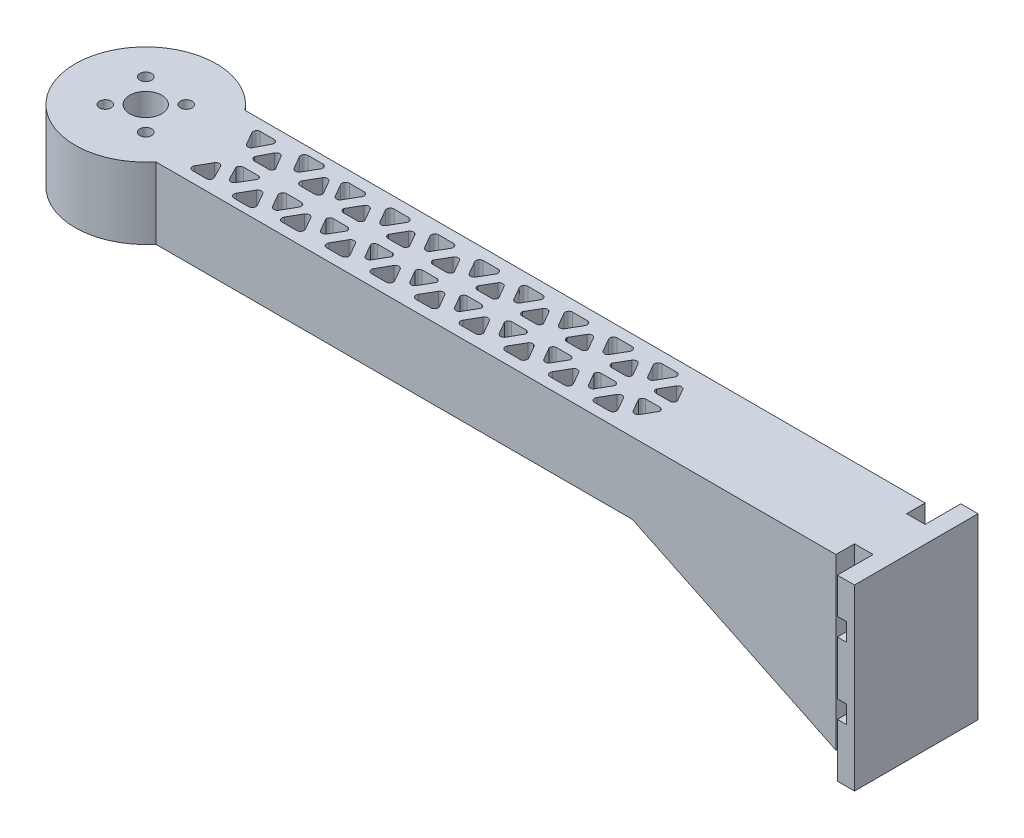
from build123d import *

# Parameters (mm, degrees)
SKETCH1_R           = 1.65
SKETCH1_R_2         = 4.5
BOSS_EXTRUDE1_DEPTH = 20
BOSS_EXTRUDE2_DEPTH = 50
BOSS_EXTRUDE3_DEPTH = 25
CUT_EXTRUDE1_REACH  = 224.387
SKETCH2_4_W         = 5.2
SKETCH2_4_H         = 5.2
CUT_EXTRUDE2_REACH  = 222.99
SKETCH4_W           = 2.5
SKETCH4_H           = 5
SKETCH4_W_2         = 0.1


with BuildPart() as part:
    # Sketch1 → Boss-Extrude1 (new body)
    with BuildSketch(Plane(origin=(0, 0, 0), x_dir=(1, 0, 0), z_dir=(0, 1, 0))):
        with BuildLine():
            Line((215.781228136, 12.419661208), (15.251683783, 12.419661208))
            ThreePointArc((15.251683783, 12.419661208), (-19.862171776, -0.080338792), (15.251683783, -12.580338792))
            Line((15.251683783, -12.580338792), (215.781228136, -12.580338792))
            Line((215.781228136, -12.580338792), (215.781228136, 12.419661208))
        make_face()
        with BuildLine():
            ThreePointArc((40.028484267, -8.923117966), (40.028697604, -9.947176998), (39.141872006, -10.459268109))
            Line((39.141872006, -10.459268109), (35.007344818, -10.459268109))
            ThreePointArc((35.007344818, -10.459268109), (34.12051922, -9.947176998), (34.120732557, -8.923117966))
            Line((34.120732557, -8.923117966), (36.187996151, -5.34480815))
            ThreePointArc((36.187996151, -5.34480815), (37.074608412, -4.833086491), (37.961220673, -5.34480815))
            Line((37.961220673, -5.34480815), (40.028484267, -8.923117966))
        make_face(mode=Mode.SUBTRACT)
        with BuildLine():
            Line((21.614703637, -8.12452744), (23.681967231, -4.546217624))
            ThreePointArc((23.681967231, -4.546217624), (24.543612682, -4.061494427), (25.383043849, -4.583744154))
            Line((25.383043849, -4.583744154), (27.244871966, -8.162053969))
            ThreePointArc((27.244871966, -8.162053969), (27.213581729, -9.113447541), (26.384038862, -9.580338792))
            Line((26.384038862, -9.580338792), (22.454947151, -9.580338792))
            ThreePointArc((22.454947151, -9.580338792), (21.614501458, -9.095029425), (21.614703637, -8.12452744))
        make_face(mode=Mode.SUBTRACT)
        with BuildLine():
            ThreePointArc((27.803132488, -2.735420106), (28.041756396, -1.959117555), (28.760166912, -1.580338792))
            Line((28.760166912, -1.580338792), (33.170984506, -1.580338792))
            ThreePointArc((33.170984506, -1.580338792), (33.622927159, -1.975727629), (33.775469807, -2.556516089))
            Line((33.775469807, -2.556516089), (31.573625479, -6.255367121))
            ThreePointArc((31.573625479, -6.255367121), (30.697555502, -6.931576396), (29.718236674, -6.416122982))
            Line((29.718236674, -6.416122982), (27.803132488, -2.735420106))
        make_face(mode=Mode.SUBTRACT)
        with BuildLine():
            Line((46.634703637, -7.963849857), (48.701967231, -4.385540041))
            ThreePointArc((48.701967231, -4.385540041), (49.588579492, -3.873818381), (50.475191753, -4.385540041))
            Line((50.475191753, -4.385540041), (52.542455347, -7.963849857))
            ThreePointArc((52.542455347, -7.963849857), (52.542668684, -8.987908889), (51.655843086, -9.5))
            Line((51.655843086, -9.5), (47.521315898, -9.5))
            ThreePointArc((47.521315898, -9.5), (46.6344903, -8.987908889), (46.634703637, -7.963849857))
        make_face(mode=Mode.SUBTRACT)
        with BuildLine():
            Line((59.144703637, -7.963849857), (61.211967231, -4.385540041))
            ThreePointArc((61.211967231, -4.385540041), (62.098579492, -3.873818381), (62.985191753, -4.385540041))
            Line((62.985191753, -4.385540041), (65.052455347, -7.963849857))
            ThreePointArc((65.052455347, -7.963849857), (65.052668684, -8.987908889), (64.165843086, -9.5))
            Line((64.165843086, -9.5), (60.031315898, -9.5))
            ThreePointArc((60.031315898, -9.5), (59.1444903, -8.987908889), (59.144703637, -7.963849857))
        make_face(mode=Mode.SUBTRACT)
        with BuildLine():
            Line((71.654703637, -7.963849857), (73.721967231, -4.385540041))
            ThreePointArc((73.721967231, -4.385540041), (74.608579492, -3.873818381), (75.495191753, -4.385540041))
            Line((75.495191753, -4.385540041), (77.562455347, -7.963849857))
            ThreePointArc((77.562455347, -7.963849857), (77.562668684, -8.987908889), (76.675843086, -9.5))
            Line((76.675843086, -9.5), (72.541315898, -9.5))
            ThreePointArc((72.541315898, -9.5), (71.6544903, -8.987908889), (71.654703637, -7.963849857))
        make_face(mode=Mode.SUBTRACT)
        with BuildLine():
            Line((84.164703637, -7.963849857), (86.231967231, -4.385540041))
            ThreePointArc((86.231967231, -4.385540041), (87.118579492, -3.873818381), (88.005191753, -4.385540041))
            Line((88.005191753, -4.385540041), (90.072455347, -7.963849857))
            ThreePointArc((90.072455347, -7.963849857), (90.072668684, -8.987908889), (89.185843086, -9.5))
            Line((89.185843086, -9.5), (85.051315898, -9.5))
            ThreePointArc((85.051315898, -9.5), (84.1644903, -8.987908889), (84.164703637, -7.963849857))
        make_face(mode=Mode.SUBTRACT)
        with BuildLine():
            Line((46.281498727, -3.523632181), (44.214235133, -7.101941997))
            ThreePointArc((44.214235133, -7.101941997), (43.327622872, -7.613663657), (42.441010611, -7.101941997))
            Line((42.441010611, -7.101941997), (40.373261673, -3.514943175))
            ThreePointArc((40.373261673, -3.514943175), (40.373776477, -2.491304726), (41.260359278, -1.979634055))
            Line((41.260359278, -1.979634055), (45.394886466, -1.979634055))
            ThreePointArc((45.394886466, -1.979634055), (46.287424275, -2.493670166), (46.281498727, -3.523632181))
        make_face(mode=Mode.SUBTRACT)
        with BuildLine():
            ThreePointArc((52.887718097, -2.564364072), (53.123716588, -1.859495358), (53.774330358, -1.5))
            Line((53.774330358, -1.5), (57.908857546, -1.5))
            ThreePointArc((57.908857546, -1.5), (58.556731527, -1.85658781), (58.795469807, -2.556516089))
            Line((58.795469807, -2.556516089), (56.728206213, -6.142673887))
            ThreePointArc((56.728206213, -6.142673887), (55.841593952, -6.654395547), (54.954981691, -6.142673887))
            Line((54.954981691, -6.142673887), (52.887718097, -2.564364072))
        make_face(mode=Mode.SUBTRACT)
        with BuildLine():
            ThreePointArc((65.397718097, -2.564364072), (65.633716588, -1.859495358), (66.284330358, -1.5))
            Line((66.284330358, -1.5), (70.418857546, -1.5))
            ThreePointArc((70.418857546, -1.5), (71.066731527, -1.85658781), (71.305469807, -2.556516089))
            Line((71.305469807, -2.556516089), (69.238206213, -6.142673887))
            ThreePointArc((69.238206213, -6.142673887), (68.351593952, -6.654395547), (67.464981691, -6.142673887))
            Line((67.464981691, -6.142673887), (65.397718097, -2.564364072))
        make_face(mode=Mode.SUBTRACT)
        with BuildLine():
            ThreePointArc((77.907718097, -2.564364072), (78.143716588, -1.859495358), (78.794330358, -1.5))
            Line((78.794330358, -1.5), (82.928857546, -1.5))
            ThreePointArc((82.928857546, -1.5), (83.576731527, -1.85658781), (83.815469807, -2.556516089))
            Line((83.815469807, -2.556516089), (81.748206213, -6.142673887))
            ThreePointArc((81.748206213, -6.142673887), (80.861593952, -6.654395547), (79.974981691, -6.142673887))
            Line((79.974981691, -6.142673887), (77.907718097, -2.564364072))
        make_face(mode=Mode.SUBTRACT)
        with BuildLine():
            ThreePointArc((90.417718097, -2.564364072), (90.653716588, -1.859495358), (91.304330358, -1.5))
            Line((91.304330358, -1.5), (95.438857546, -1.5))
            ThreePointArc((95.438857546, -1.5), (96.086731527, -1.85658781), (96.325469807, -2.556516089))
            Line((96.325469807, -2.556516089), (94.258206213, -6.142673887))
            ThreePointArc((94.258206213, -6.142673887), (93.371593952, -6.654395547), (92.484981691, -6.142673887))
            Line((92.484981691, -6.142673887), (90.417718097, -2.564364072))
        make_face(mode=Mode.SUBTRACT)
        with BuildLine():
            Line((96.674703637, -7.963849857), (98.741967231, -4.385540041))
            ThreePointArc((98.741967231, -4.385540041), (99.628579492, -3.873818381), (100.515191753, -4.385540041))
            Line((100.515191753, -4.385540041), (102.582455347, -7.963849857))
            ThreePointArc((102.582455347, -7.963849857), (102.582668684, -8.987908889), (101.695843086, -9.5))
            Line((101.695843086, -9.5), (97.561315898, -9.5))
            ThreePointArc((97.561315898, -9.5), (96.6744903, -8.987908889), (96.674703637, -7.963849857))
        make_face(mode=Mode.SUBTRACT)
        with BuildLine():
            Line((109.184703637, -7.963849857), (111.251967231, -4.385540041))
            ThreePointArc((111.251967231, -4.385540041), (112.138579492, -3.873818381), (113.025191753, -4.385540041))
            Line((113.025191753, -4.385540041), (115.092455347, -7.963849857))
            ThreePointArc((115.092455347, -7.963849857), (115.092668684, -8.987908889), (114.205843086, -9.5))
            Line((114.205843086, -9.5), (110.071315898, -9.5))
            ThreePointArc((110.071315898, -9.5), (109.1844903, -8.987908889), (109.184703637, -7.963849857))
        make_face(mode=Mode.SUBTRACT)
        with BuildLine():
            Line((121.694703637, -7.963849857), (123.761967231, -4.385540041))
            ThreePointArc((123.761967231, -4.385540041), (124.648579492, -3.873818381), (125.535191753, -4.385540041))
            Line((125.535191753, -4.385540041), (127.602455347, -7.963849857))
            ThreePointArc((127.602455347, -7.963849857), (127.602668684, -8.987908889), (126.715843086, -9.5))
            Line((126.715843086, -9.5), (122.581315898, -9.5))
            ThreePointArc((122.581315898, -9.5), (121.6944903, -8.987908889), (121.694703637, -7.963849857))
        make_face(mode=Mode.SUBTRACT)
        with BuildLine():
            Line((134.204703637, -7.963849857), (136.271967231, -4.385540041))
            ThreePointArc((136.271967231, -4.385540041), (137.158579492, -3.873818381), (138.045191753, -4.385540041))
            Line((138.045191753, -4.385540041), (140.112455347, -7.963849857))
            ThreePointArc((140.112455347, -7.963849857), (140.112668684, -8.987908889), (139.225843086, -9.5))
            Line((139.225843086, -9.5), (135.091315898, -9.5))
            ThreePointArc((135.091315898, -9.5), (134.2044903, -8.987908889), (134.204703637, -7.963849857))
        make_face(mode=Mode.SUBTRACT)
        with BuildLine():
            ThreePointArc((102.927718097, -2.564364072), (103.163716588, -1.859495358), (103.814330358, -1.5))
            Line((103.814330358, -1.5), (107.948857546, -1.5))
            ThreePointArc((107.948857546, -1.5), (108.596731527, -1.85658781), (108.835469807, -2.556516089))
            Line((108.835469807, -2.556516089), (106.768206213, -6.142673887))
            ThreePointArc((106.768206213, -6.142673887), (105.881593952, -6.654395547), (104.994981691, -6.142673887))
            Line((104.994981691, -6.142673887), (102.927718097, -2.564364072))
        make_face(mode=Mode.SUBTRACT)
        with BuildLine():
            ThreePointArc((115.437718097, -2.564364072), (115.673716588, -1.859495358), (116.324330358, -1.5))
            Line((116.324330358, -1.5), (120.458857546, -1.5))
            ThreePointArc((120.458857546, -1.5), (121.106731527, -1.85658781), (121.345469807, -2.556516089))
            Line((121.345469807, -2.556516089), (119.278206213, -6.142673887))
            ThreePointArc((119.278206213, -6.142673887), (118.391593952, -6.654395547), (117.504981691, -6.142673887))
            Line((117.504981691, -6.142673887), (115.437718097, -2.564364072))
        make_face(mode=Mode.SUBTRACT)
        with BuildLine():
            ThreePointArc((127.947718097, -2.564364072), (128.183716588, -1.859495358), (128.834330358, -1.5))
            Line((128.834330358, -1.5), (132.968857546, -1.5))
            ThreePointArc((132.968857546, -1.5), (133.616731527, -1.85658781), (133.855469807, -2.556516089))
            Line((133.855469807, -2.556516089), (131.788206213, -6.142673887))
            ThreePointArc((131.788206213, -6.142673887), (130.901593952, -6.654395547), (130.014981691, -6.142673887))
            Line((130.014981691, -6.142673887), (127.947718097, -2.564364072))
        make_face(mode=Mode.SUBTRACT)
        with BuildLine():
            ThreePointArc((140.457718097, -2.564364072), (140.693716588, -1.859495358), (141.344330358, -1.5))
            Line((141.344330358, -1.5), (145.478857546, -1.5))
            ThreePointArc((145.478857546, -1.5), (146.126731527, -1.85658781), (146.365469807, -2.556516089))
            Line((146.365469807, -2.556516089), (144.298206213, -6.142673887))
            ThreePointArc((144.298206213, -6.142673887), (143.411593952, -6.654395547), (142.524981691, -6.142673887))
            Line((142.524981691, -6.142673887), (140.457718097, -2.564364072))
        make_face(mode=Mode.SUBTRACT)
        with BuildLine():
            Line((27.803132488, 2.574742523), (29.718236674, 6.255445399))
            ThreePointArc((29.718236674, 6.255445399), (30.697555502, 6.770898813), (31.573625479, 6.094689538))
            Line((31.573625479, 6.094689538), (33.775469807, 2.395838506))
            ThreePointArc((33.775469807, 2.395838506), (33.622927159, 1.815050046), (33.170984506, 1.419661208))
            Line((33.170984506, 1.419661208), (28.760166912, 1.419661208))
            ThreePointArc((28.760166912, 1.419661208), (28.041756396, 1.798439972), (27.803132488, 2.574742523))
        make_face(mode=Mode.SUBTRACT)
        with BuildLine():
            ThreePointArc((21.614703637, 7.963849857), (21.614501458, 8.934351842), (22.454947151, 9.419661208))
            Line((22.454947151, 9.419661208), (26.384038862, 9.419661208))
            ThreePointArc((26.384038862, 9.419661208), (27.213581729, 8.952769958), (27.244871966, 8.001376386))
            Line((27.244871966, 8.001376386), (25.383043849, 4.423066571))
            ThreePointArc((25.383043849, 4.423066571), (24.543612682, 3.900816844), (23.681967231, 4.385540041))
            Line((23.681967231, 4.385540041), (21.614703637, 7.963849857))
        make_face(mode=Mode.SUBTRACT)
        with BuildLine():
            Line((40.028484267, 8.762440383), (37.961220673, 5.184130567))
            ThreePointArc((37.961220673, 5.184130567), (37.074608412, 4.672408908), (36.187996151, 5.184130567))
            Line((36.187996151, 5.184130567), (34.120732557, 8.762440383))
            ThreePointArc((34.120732557, 8.762440383), (34.12051922, 9.786499415), (35.007344818, 10.298590526))
            Line((35.007344818, 10.298590526), (39.141872006, 10.298590526))
            ThreePointArc((39.141872006, 10.298590526), (40.028697604, 9.786499415), (40.028484267, 8.762440383))
        make_face(mode=Mode.SUBTRACT)
        with BuildLine():
            ThreePointArc((46.281498727, 3.362954598), (46.287424275, 2.332992583), (45.394886466, 1.818956472))
            Line((45.394886466, 1.818956472), (41.260359278, 1.818956472))
            ThreePointArc((41.260359278, 1.818956472), (40.373776477, 2.330627143), (40.373261673, 3.354265592))
            Line((40.373261673, 3.354265592), (42.441010611, 6.941264414))
            ThreePointArc((42.441010611, 6.941264414), (43.327622872, 7.452986074), (44.214235133, 6.941264414))
            Line((44.214235133, 6.941264414), (46.281498727, 3.362954598))
        make_face(mode=Mode.SUBTRACT)
        with BuildLine():
            Line((52.887718097, 2.403686489), (54.954981691, 5.981996304))
            ThreePointArc((54.954981691, 5.981996304), (55.841593952, 6.493717964), (56.728206213, 5.981996304))
            Line((56.728206213, 5.981996304), (58.795469807, 2.395838506))
            ThreePointArc((58.795469807, 2.395838506), (58.556731527, 1.695910227), (57.908857546, 1.339322417))
            Line((57.908857546, 1.339322417), (53.774330358, 1.339322417))
            ThreePointArc((53.774330358, 1.339322417), (53.123716588, 1.698817775), (52.887718097, 2.403686489))
        make_face(mode=Mode.SUBTRACT)
        with BuildLine():
            Line((65.397718097, 2.403686489), (67.464981691, 5.981996304))
            ThreePointArc((67.464981691, 5.981996304), (68.351593952, 6.493717964), (69.238206213, 5.981996304))
            Line((69.238206213, 5.981996304), (71.305469807, 2.395838506))
            ThreePointArc((71.305469807, 2.395838506), (71.066731527, 1.695910227), (70.418857546, 1.339322417))
            Line((70.418857546, 1.339322417), (66.284330358, 1.339322417))
            ThreePointArc((66.284330358, 1.339322417), (65.633716588, 1.698817775), (65.397718097, 2.403686489))
        make_face(mode=Mode.SUBTRACT)
        with BuildLine():
            Line((77.907718097, 2.403686489), (79.974981691, 5.981996304))
            ThreePointArc((79.974981691, 5.981996304), (80.861593952, 6.493717964), (81.748206213, 5.981996304))
            Line((81.748206213, 5.981996304), (83.815469807, 2.395838506))
            ThreePointArc((83.815469807, 2.395838506), (83.576731527, 1.695910227), (82.928857546, 1.339322417))
            Line((82.928857546, 1.339322417), (78.794330358, 1.339322417))
            ThreePointArc((78.794330358, 1.339322417), (78.143716588, 1.698817775), (77.907718097, 2.403686489))
        make_face(mode=Mode.SUBTRACT)
        with BuildLine():
            Line((90.417718097, 2.403686489), (92.484981691, 5.981996304))
            ThreePointArc((92.484981691, 5.981996304), (93.371593952, 6.493717964), (94.258206213, 5.981996304))
            Line((94.258206213, 5.981996304), (96.325469807, 2.395838506))
            ThreePointArc((96.325469807, 2.395838506), (96.086731527, 1.695910227), (95.438857546, 1.339322417))
            Line((95.438857546, 1.339322417), (91.304330358, 1.339322417))
            ThreePointArc((91.304330358, 1.339322417), (90.653716588, 1.698817775), (90.417718097, 2.403686489))
        make_face(mode=Mode.SUBTRACT)
        with BuildLine():
            ThreePointArc((46.634703637, 7.803172274), (46.6344903, 8.827231306), (47.521315898, 9.339322417))
            Line((47.521315898, 9.339322417), (51.655843086, 9.339322417))
            ThreePointArc((51.655843086, 9.339322417), (52.542668684, 8.827231306), (52.542455347, 7.803172274))
            Line((52.542455347, 7.803172274), (50.475191753, 4.224862458))
            ThreePointArc((50.475191753, 4.224862458), (49.588579492, 3.713140798), (48.701967231, 4.224862458))
            Line((48.701967231, 4.224862458), (46.634703637, 7.803172274))
        make_face(mode=Mode.SUBTRACT)
        with BuildLine():
            ThreePointArc((59.144703637, 7.803172274), (59.1444903, 8.827231306), (60.031315898, 9.339322417))
            Line((60.031315898, 9.339322417), (64.165843086, 9.339322417))
            ThreePointArc((64.165843086, 9.339322417), (65.052668684, 8.827231306), (65.052455347, 7.803172274))
            Line((65.052455347, 7.803172274), (62.985191753, 4.224862458))
            ThreePointArc((62.985191753, 4.224862458), (62.098579492, 3.713140798), (61.211967231, 4.224862458))
            Line((61.211967231, 4.224862458), (59.144703637, 7.803172274))
        make_face(mode=Mode.SUBTRACT)
        with BuildLine():
            ThreePointArc((71.654703637, 7.803172274), (71.6544903, 8.827231306), (72.541315898, 9.339322417))
            Line((72.541315898, 9.339322417), (76.675843086, 9.339322417))
            ThreePointArc((76.675843086, 9.339322417), (77.562668684, 8.827231306), (77.562455347, 7.803172274))
            Line((77.562455347, 7.803172274), (75.495191753, 4.224862458))
            ThreePointArc((75.495191753, 4.224862458), (74.608579492, 3.713140798), (73.721967231, 4.224862458))
            Line((73.721967231, 4.224862458), (71.654703637, 7.803172274))
        make_face(mode=Mode.SUBTRACT)
        with BuildLine():
            ThreePointArc((84.164703637, 7.803172274), (84.1644903, 8.827231306), (85.051315898, 9.339322417))
            Line((85.051315898, 9.339322417), (89.185843086, 9.339322417))
            ThreePointArc((89.185843086, 9.339322417), (90.072668684, 8.827231306), (90.072455347, 7.803172274))
            Line((90.072455347, 7.803172274), (88.005191753, 4.224862458))
            ThreePointArc((88.005191753, 4.224862458), (87.118579492, 3.713140798), (86.231967231, 4.224862458))
            Line((86.231967231, 4.224862458), (84.164703637, 7.803172274))
        make_face(mode=Mode.SUBTRACT)
        with BuildLine():
            Line((102.927718097, 2.403686489), (104.994981691, 5.981996304))
            ThreePointArc((104.994981691, 5.981996304), (105.881593952, 6.493717964), (106.768206213, 5.981996304))
            Line((106.768206213, 5.981996304), (108.835469807, 2.395838506))
            ThreePointArc((108.835469807, 2.395838506), (108.596731527, 1.695910227), (107.948857546, 1.339322417))
            Line((107.948857546, 1.339322417), (103.814330358, 1.339322417))
            ThreePointArc((103.814330358, 1.339322417), (103.163716588, 1.698817775), (102.927718097, 2.403686489))
        make_face(mode=Mode.SUBTRACT)
        with BuildLine():
            Line((115.437718097, 2.403686489), (117.504981691, 5.981996304))
            ThreePointArc((117.504981691, 5.981996304), (118.391593952, 6.493717964), (119.278206213, 5.981996304))
            Line((119.278206213, 5.981996304), (121.345469807, 2.395838506))
            ThreePointArc((121.345469807, 2.395838506), (121.106731527, 1.695910227), (120.458857546, 1.339322417))
            Line((120.458857546, 1.339322417), (116.324330358, 1.339322417))
            ThreePointArc((116.324330358, 1.339322417), (115.673716588, 1.698817775), (115.437718097, 2.403686489))
        make_face(mode=Mode.SUBTRACT)
        with BuildLine():
            Line((127.947718097, 2.403686489), (130.014981691, 5.981996304))
            ThreePointArc((130.014981691, 5.981996304), (130.901593952, 6.493717964), (131.788206213, 5.981996304))
            Line((131.788206213, 5.981996304), (133.855469807, 2.395838506))
            ThreePointArc((133.855469807, 2.395838506), (133.616731527, 1.695910227), (132.968857546, 1.339322417))
            Line((132.968857546, 1.339322417), (128.834330358, 1.339322417))
            ThreePointArc((128.834330358, 1.339322417), (128.183716588, 1.698817775), (127.947718097, 2.403686489))
        make_face(mode=Mode.SUBTRACT)
        with BuildLine():
            Line((140.457718097, 2.403686489), (142.524981691, 5.981996304))
            ThreePointArc((142.524981691, 5.981996304), (143.411593952, 6.493717964), (144.298206213, 5.981996304))
            Line((144.298206213, 5.981996304), (146.365469807, 2.395838506))
            ThreePointArc((146.365469807, 2.395838506), (146.126731527, 1.695910227), (145.478857546, 1.339322417))
            Line((145.478857546, 1.339322417), (141.344330358, 1.339322417))
            ThreePointArc((141.344330358, 1.339322417), (140.693716588, 1.698817775), (140.457718097, 2.403686489))
        make_face(mode=Mode.SUBTRACT)
        with BuildLine():
            ThreePointArc((96.674703637, 7.803172274), (96.6744903, 8.827231306), (97.561315898, 9.339322417))
            Line((97.561315898, 9.339322417), (101.695843086, 9.339322417))
            ThreePointArc((101.695843086, 9.339322417), (102.582668684, 8.827231306), (102.582455347, 7.803172274))
            Line((102.582455347, 7.803172274), (100.515191753, 4.224862458))
            ThreePointArc((100.515191753, 4.224862458), (99.628579492, 3.713140798), (98.741967231, 4.224862458))
            Line((98.741967231, 4.224862458), (96.674703637, 7.803172274))
        make_face(mode=Mode.SUBTRACT)
        with BuildLine():
            ThreePointArc((109.184703637, 7.803172274), (109.1844903, 8.827231306), (110.071315898, 9.339322417))
            Line((110.071315898, 9.339322417), (114.205843086, 9.339322417))
            ThreePointArc((114.205843086, 9.339322417), (115.092668684, 8.827231306), (115.092455347, 7.803172274))
            Line((115.092455347, 7.803172274), (113.025191753, 4.224862458))
            ThreePointArc((113.025191753, 4.224862458), (112.138579492, 3.713140798), (111.251967231, 4.224862458))
            Line((111.251967231, 4.224862458), (109.184703637, 7.803172274))
        make_face(mode=Mode.SUBTRACT)
        with BuildLine():
            ThreePointArc((121.694703637, 7.803172274), (121.6944903, 8.827231306), (122.581315898, 9.339322417))
            Line((122.581315898, 9.339322417), (126.715843086, 9.339322417))
            ThreePointArc((126.715843086, 9.339322417), (127.602668684, 8.827231306), (127.602455347, 7.803172274))
            Line((127.602455347, 7.803172274), (125.535191753, 4.224862458))
            ThreePointArc((125.535191753, 4.224862458), (124.648579492, 3.713140798), (123.761967231, 4.224862458))
            Line((123.761967231, 4.224862458), (121.694703637, 7.803172274))
        make_face(mode=Mode.SUBTRACT)
        with BuildLine():
            ThreePointArc((134.204703637, 7.803172274), (134.2044903, 8.827231306), (135.091315898, 9.339322417))
            Line((135.091315898, 9.339322417), (139.225843086, 9.339322417))
            ThreePointArc((139.225843086, 9.339322417), (140.112668684, 8.827231306), (140.112455347, 7.803172274))
            Line((140.112455347, 7.803172274), (138.045191753, 4.224862458))
            ThreePointArc((138.045191753, 4.224862458), (137.158579492, 3.713140798), (136.271967231, 4.224862458))
            Line((136.271967231, 4.224862458), (134.204703637, 7.803172274))
        make_face(mode=Mode.SUBTRACT)
        with Locations(Location((-6.797853213, 6.63717563, 0), (0, 0, 270))):
            Circle(SKETCH1_R, mode=Mode.SUBTRACT)
        with Locations(Location((5.576515458, 5.576515458, 0), (0, 0, 270))):
            Circle(SKETCH1_R, mode=Mode.SUBTRACT)
        with Locations(Location((-5.737193041, -5.737193041, 0), (0, 0, 270))):
            Circle(SKETCH1_R, mode=Mode.SUBTRACT)
        with Locations(Location((6.63717563, -6.797853213, 0), (0, 0, 270))):
            Circle(SKETCH1_R, mode=Mode.SUBTRACT)
        with Locations(Location((-0.080338792, -0.080338792, 0), (0, 0, 270))):
            Circle(SKETCH1_R_2, mode=Mode.SUBTRACT)
    extrude(amount=BOSS_EXTRUDE1_DEPTH)

    # Sketch2 → Boss-Extrude2 (add)
    with BuildSketch(Plane(origin=(0, 20, 0), x_dir=(1, 0, 0), z_dir=(0, 1, 0))):
        Polygon((215.781228136, -17.380338792), (215.781228136, -12.580338792), (215.781228136, 12.419661208), (215.781228136, 17.219661208), (210.981228136, 17.219661208), (210.981228136, -12.580338792), (210.981228136, -17.380338792), align=None)
    extrude(amount=-BOSS_EXTRUDE2_DEPTH)

    # Sketch3 → Boss-Extrude3 (add)
    with BuildSketch(Plane.XY.offset(12.580338792)):
        Polygon((210.981228136, 0), (148.781228136, 0), (210.981228136, -30), align=None)
    extrude(amount=-BOSS_EXTRUDE3_DEPTH)

    # Cut-Extrude1: up to this plane
    cut_extrude1_end = Plane(origin=(210.981228136, -30, -81.476449434), z_dir=(-0.4344250691489581, -0.9007079767021735, 0))
    # Sketch2<4> → Cut-Extrude1 (cut, up to the surface)
    with BuildSketch(Plane(origin=(0, 20, 0), x_dir=(1, 0, 0), z_dir=(0, 1, 0)), mode=Mode.PRIVATE) as cut_extrude1_sk1:
        with Locations((208.381228136, 9.819661208)):
            Rectangle(SKETCH2_4_W, SKETCH2_4_H)
    cut_extrude1_tool1 = split(extrude(cut_extrude1_sk1.sketch, amount=-CUT_EXTRUDE1_REACH, mode=Mode.PRIVATE), bisect_by=cut_extrude1_end, keep=Keep.BOTH, mode=Mode.PRIVATE)
    add(cut_extrude1_tool1.solids().sort_by_distance((208.381228, 20, -9.819661))[0], mode=Mode.SUBTRACT)
    # Sketch2<4> → Cut-Extrude1 (cut, up to the surface)
    with BuildSketch(Plane(origin=(0, 20, 0), x_dir=(1, 0, 0), z_dir=(0, 1, 0)), mode=Mode.PRIVATE) as cut_extrude1_sk2:
        with Locations((208.381228136, -9.980338792)):
            Rectangle(SKETCH2_4_W, SKETCH2_4_H)
    cut_extrude1_tool2 = split(extrude(cut_extrude1_sk2.sketch, amount=-CUT_EXTRUDE1_REACH, mode=Mode.PRIVATE), bisect_by=cut_extrude1_end, keep=Keep.BOTH, mode=Mode.PRIVATE)
    add(cut_extrude1_tool2.solids().sort_by_distance((208.381228, 20, 9.980339))[0], mode=Mode.SUBTRACT)

    # Cut-Extrude2: up to this face of the body (flat: up to its plane)
    cut_extrude2_end = Plane(part.part.faces().sort_by_distance((213.381228136, -5, -17.219661208))[0])
    # Sketch4 → Cut-Extrude2 (cut, up to the picked face)
    with BuildSketch(Plane.XY.offset(17.380338792), mode=Mode.PRIVATE) as cut_extrude2_sk1:
        with Locations((209.731228136, -12.5)):
            Rectangle(SKETCH4_W, SKETCH4_H)
    cut_extrude2_tool1 = split(extrude(cut_extrude2_sk1.sketch, amount=-CUT_EXTRUDE2_REACH, mode=Mode.PRIVATE), bisect_by=cut_extrude2_end, keep=Keep.BOTH, mode=Mode.PRIVATE)
    # Sketch4 → Cut-Extrude2 (cut, up to the picked face)
    with BuildSketch(Plane.XY.offset(17.380338792), mode=Mode.PRIVATE) as cut_extrude2_sk2:
        with Locations((212.231228136, -12.5)):
            Rectangle(SKETCH4_W, SKETCH4_H)
    cut_extrude2_tool2 = split(extrude(cut_extrude2_sk2.sketch, amount=-CUT_EXTRUDE2_REACH, mode=Mode.PRIVATE), bisect_by=cut_extrude2_end, keep=Keep.BOTH, mode=Mode.PRIVATE)
    # Sketch4 → Cut-Extrude2 (cut, up to the picked face)
    with BuildSketch(Plane.XY.offset(17.380338792), mode=Mode.PRIVATE) as cut_extrude2_sk3:
        with Locations((209.731228136, 7.5)):
            Rectangle(SKETCH4_W, SKETCH4_H)
    cut_extrude2_tool3 = split(extrude(cut_extrude2_sk3.sketch, amount=-CUT_EXTRUDE2_REACH, mode=Mode.PRIVATE), bisect_by=cut_extrude2_end, keep=Keep.BOTH, mode=Mode.PRIVATE)
    # Sketch4 → Cut-Extrude2 (cut, up to the picked face)
    with BuildSketch(Plane.XY.offset(17.380338792), mode=Mode.PRIVATE) as cut_extrude2_sk4:
        with Locations((212.231228136, 7.5)):
            Rectangle(SKETCH4_W, SKETCH4_H)
    cut_extrude2_tool4 = split(extrude(cut_extrude2_sk4.sketch, amount=-CUT_EXTRUDE2_REACH, mode=Mode.PRIVATE), bisect_by=cut_extrude2_end, keep=Keep.BOTH, mode=Mode.PRIVATE)
    # Sketch4 → Cut-Extrude2 (cut, up to the picked face)
    with BuildSketch(Plane.XY.offset(17.380338792), mode=Mode.PRIVATE) as cut_extrude2_sk5:
        with Locations((208.431228136, -12.5)):
            Rectangle(SKETCH4_W_2, SKETCH4_H)
    cut_extrude2_tool5 = split(extrude(cut_extrude2_sk5.sketch, amount=-CUT_EXTRUDE2_REACH, mode=Mode.PRIVATE), bisect_by=cut_extrude2_end, keep=Keep.BOTH, mode=Mode.PRIVATE)
    # Sketch4 → Cut-Extrude2 (cut, up to the picked face)
    with BuildSketch(Plane.XY.offset(17.380338792), mode=Mode.PRIVATE) as cut_extrude2_sk6:
        with Locations((208.431228136, 7.5)):
            Rectangle(SKETCH4_W_2, SKETCH4_H)
    cut_extrude2_tool6 = split(extrude(cut_extrude2_sk6.sketch, amount=-CUT_EXTRUDE2_REACH, mode=Mode.PRIVATE), bisect_by=cut_extrude2_end, keep=Keep.BOTH, mode=Mode.PRIVATE)
    add(cut_extrude2_tool1.solids().sort_by(Axis((209.731228, -12.5, 17.380339), (0, 0, -1)))[0], mode=Mode.SUBTRACT)
    add(cut_extrude2_tool2.solids().sort_by(Axis((212.231228, -12.5, 17.380339), (0, 0, -1)))[0], mode=Mode.SUBTRACT)
    add(cut_extrude2_tool3.solids().sort_by(Axis((209.731228, 7.5, 17.380339), (0, 0, -1)))[0], mode=Mode.SUBTRACT)
    add(cut_extrude2_tool4.solids().sort_by(Axis((212.231228, 7.5, 17.380339), (0, 0, -1)))[0], mode=Mode.SUBTRACT)
    add(cut_extrude2_tool5.solids().sort_by(Axis((208.431228, -12.5, 17.380339), (0, 0, -1)))[0], mode=Mode.SUBTRACT)
    add(cut_extrude2_tool6.solids().sort_by(Axis((208.431228, 7.5, 17.380339), (0, 0, -1)))[0], mode=Mode.SUBTRACT)


solid = part.part
